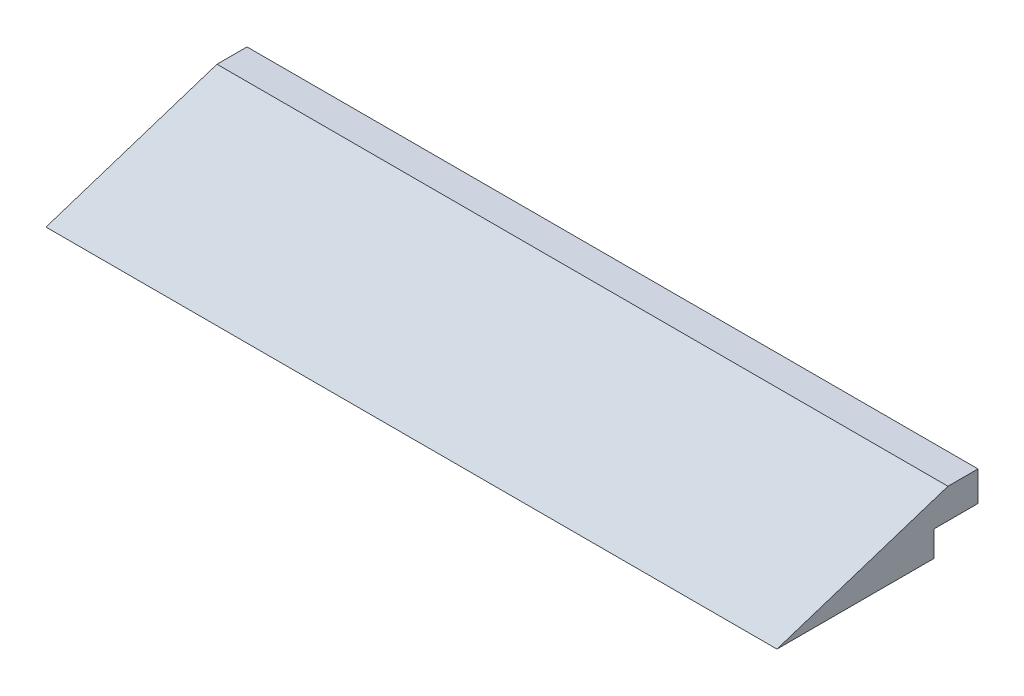
from build123d import *

# Parameters (mm, degrees)
CROQUIS1_W                 = 200
CROQUIS1_H                 = 55
SALIENTE_EXTRUIR1_DEPTH    = 15.2
CORTAR_EXTRUIR1_DEPTH      = 203.453179773
CORTAR_EXTRUIR1_DEPTH_BACK = 203.453179773
CROQUIS2_W                 = 12
CROQUIS2_H                 = 7


with BuildPart() as part:
    # Croquis1 → Saliente-Extruir1 (new body)
    with BuildSketch(Plane(origin=(0, 0, 0), x_dir=(1, 0, 0), z_dir=(0, 1, 0))):
        Rectangle(CROQUIS1_W, CROQUIS1_H)
    extrude(amount=SALIENTE_EXTRUIR1_DEPTH)

    # Croquis2 → Cortar-Extruir1 (cut, two sides: drawn at the far end of the back side and taken through both)
    with BuildSketch(Plane(origin=(100, 0, 0), x_dir=(0, 0, -1), z_dir=(1, 0, 0)).offset(-CORTAR_EXTRUIR1_DEPTH_BACK)):
        Polygon((-27.5, 0), (1.031695489, 9.270509831), (19.280789765, 15.2), (-27.5, 15.2), align=None)
        with Locations((21.5, 3.5)):
            Rectangle(CROQUIS2_W, CROQUIS2_H)
    extrude(amount=CORTAR_EXTRUIR1_DEPTH + CORTAR_EXTRUIR1_DEPTH_BACK, mode=Mode.SUBTRACT)


solid = part.part
